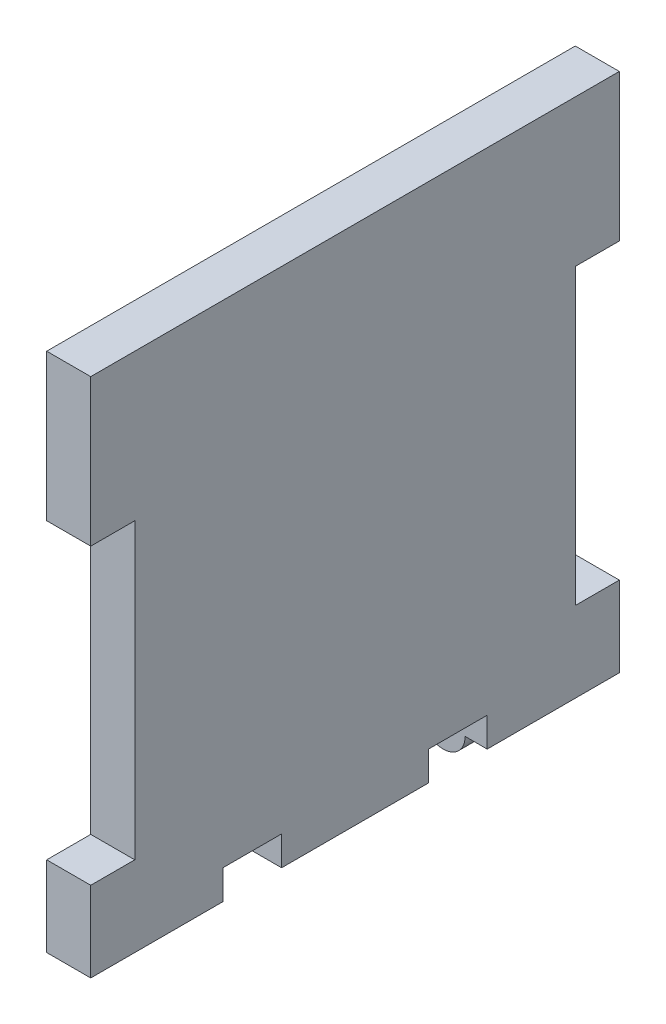
from build123d import *

# Parameters (mm, degrees)
BOSS_EXTRUDE1_DEPTH = 3
SKETCH4_R           = 1.5
BOSS_EXTRUDE2_DEPTH = 3
LPATTERN1_COUNT     = 2
LPATTERN1_PITCH     = 21
SKETCH5_W           = 4
SKETCH5_H           = 2
CUT_EXTRUDE1_DEPTH  = 10


with BuildPart() as part:
    # Sketch1 → Boss-Extrude1 (new body)
    with BuildSketch(Plane(origin=(0, 0, 0), x_dir=(0, 0, -1), z_dir=(1, 0, 0))):
        Polygon((-15, 0), (15, 0), (18, 0), (18, 5.47), (15, 5.47), (15, 25.47), (18, 25.47), (18, 35.47), (15, 35.47), (-15, 35.47), (-18, 35.47), (-18, 25.47), (-15, 25.47), (-15, 5.47), (-18, 5.47), (-18, 0), align=None)
    extrude(amount=BOSS_EXTRUDE1_DEPTH)

    # Sketch4 → Boss-Extrude2 (add)
    with BuildSketch(Plane.XY.offset(12)):
        Circle(SKETCH4_R)
    boss_extrude2 = extrude(amount=-BOSS_EXTRUDE2_DEPTH)

    # LPattern1: Boss-Extrude2 ×2
    with Locations(*[(0, 0, -i * LPATTERN1_PITCH) for i in range(1, LPATTERN1_COUNT)]):
        add(boss_extrude2)

    # Sketch5 → Cut-Extrude1 (cut)
    with BuildSketch(Plane.ZY):
        with Locations((-7, 1)):
            Rectangle(SKETCH5_W, SKETCH5_H)
        with Locations((7, 1)):
            Rectangle(SKETCH5_W, SKETCH5_H)
    extrude(amount=-CUT_EXTRUDE1_DEPTH, mode=Mode.SUBTRACT)


solid = part.part
